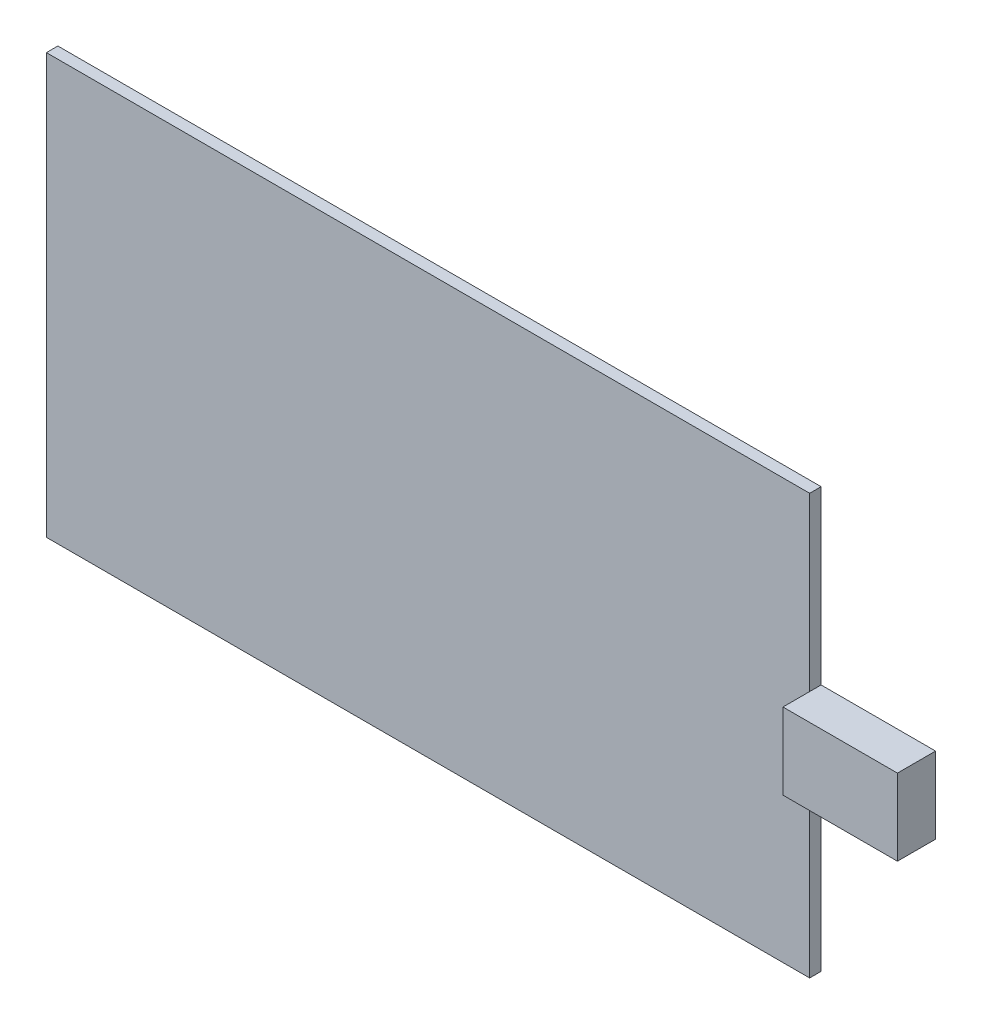
from build123d import *

# Parameters (mm, degrees)
BOSS_EXTRUDE1_DEPTH = 1.5
SKETCH1_3_W         = 15
SKETCH1_3_H         = 10
BOSS_EXTRUDE2_DEPTH = 5


with BuildPart() as part:
    # Sketch1 → Boss-Extrude1 (new body)
    with BuildSketch(Plane.XY):
        Polygon((0, -32.5), (0, -22.5), (0, 0), (-100, 0), (-100, -55), (0, -55), align=None)
    extrude(amount=BOSS_EXTRUDE1_DEPTH)

    # Sketch1<3> → Boss-Extrude2 (add)
    with BuildSketch(Plane.XY):
        with Locations((7.5, -27.5)):
            Rectangle(SKETCH1_3_W, SKETCH1_3_H)
    extrude(amount=BOSS_EXTRUDE2_DEPTH)


solid = part.part
